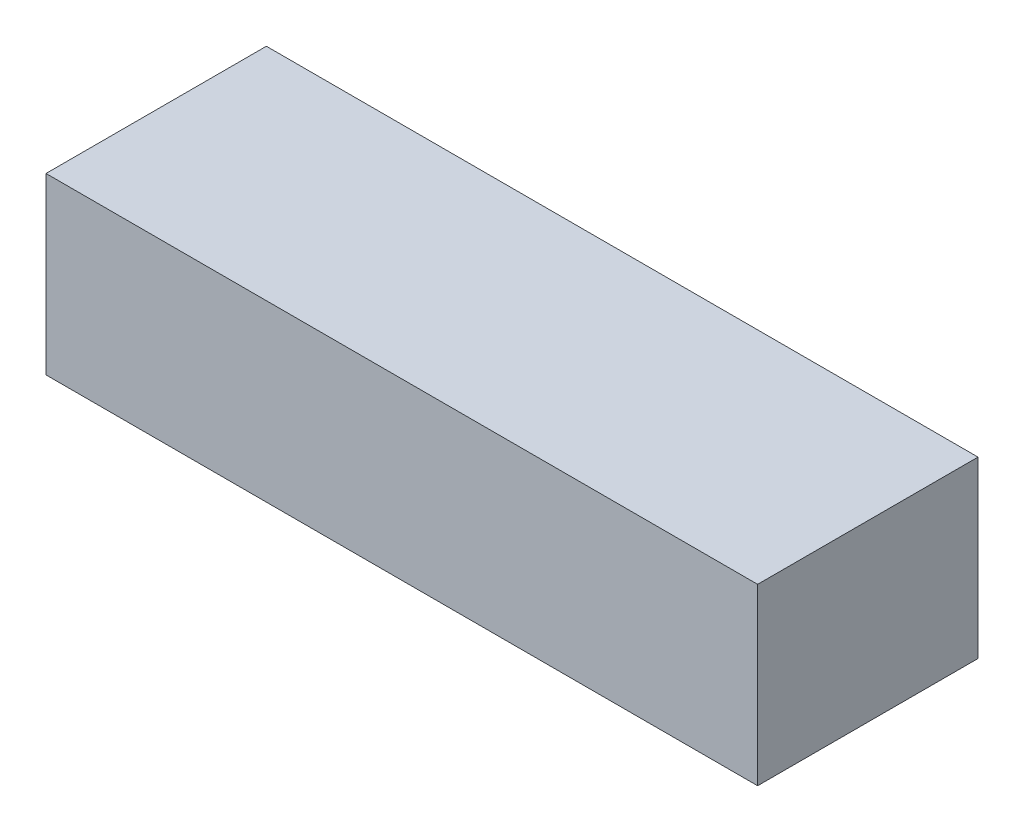
from build123d import *

# Parameters (mm, degrees)
SKETCH1_W           = 155
SKETCH1_H           = 48
BOSS_EXTRUDE1_DEPTH = 38


with BuildPart() as part:
    # Sketch1 → Boss-Extrude1 (new body)
    with BuildSketch(Plane(origin=(0, 0, 0), x_dir=(1, 0, 0), z_dir=(0, 1, 0))):
        Rectangle(SKETCH1_W, SKETCH1_H)
    extrude(amount=BOSS_EXTRUDE1_DEPTH)


solid = part.part
